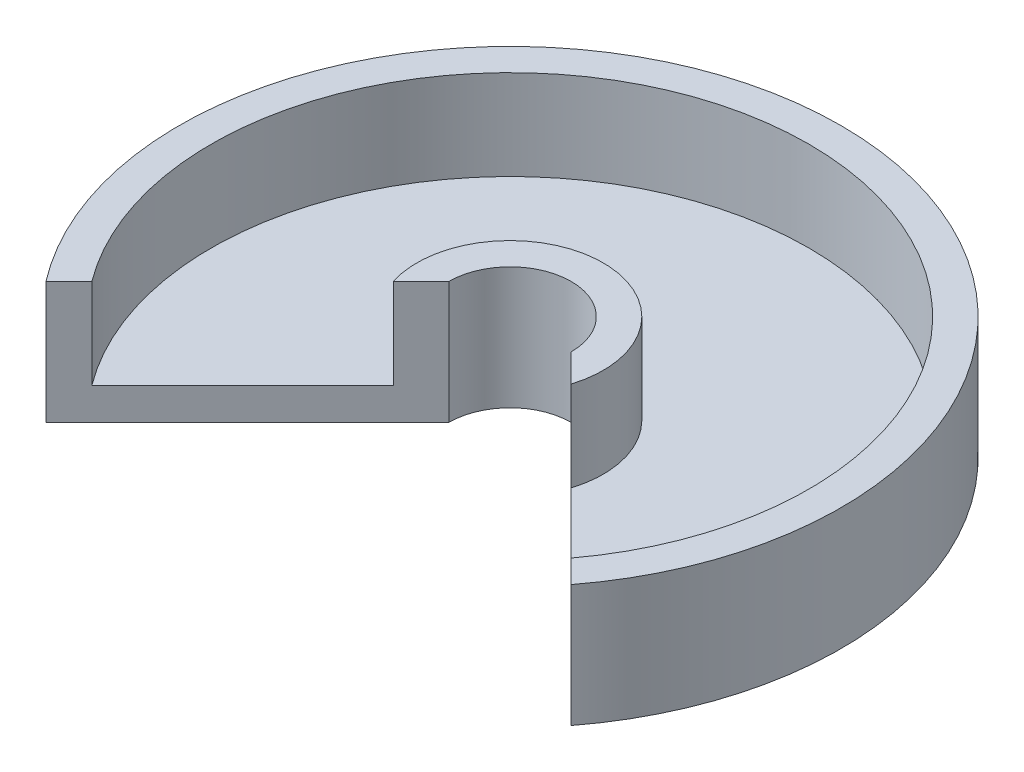
from build123d import *

# Parameters (mm, degrees)
CORTAR_EXTRUIR1_DEPTH = 10


with BuildPart() as part:
    # Croquis1 → Revolución1 (revolve)
    with BuildSketch(Plane.XY, mode=Mode.PRIVATE) as revoluci_n1_sk:
        Polygon((-17.904415608, -1.515813334), (-17.904415608, 2.284186666), (-18.904415608, 2.284186666), (-18.904415608, -0.515813334), (-25.304415608, -0.515813334), (-25.304415608, 2.284186666), (-26.304415608, 2.284186666), (-26.304415608, -1.515813334), align=None)
    revolve(revoluci_n1_sk.sketch.rotate(Axis((-16.004415608, 9.150344382, 0), (0, -1, 0)), 270), axis=Axis((-16.004415608, 9.150344382, 0), (0, -1, 0)))

    # Croquis2 → Cortar-Extruir1 (cut)
    with BuildSketch(Plane(origin=(0, 2.284186666, 0), x_dir=(1, 0, 0), z_dir=(0, 1, 0))):
        with BuildLine():
            Line((-17.904415608, 0), (-24.175391996, -6.270976388))
            ThreePointArc((-24.175391996, -6.270976388), (-16.004415608, -10.3), (-7.833439219, -6.270976388))
            Line((-7.833439219, -6.270976388), (-14.104415608, 0))
            ThreePointArc((-14.104415608, 0), (-16.004415608, -1.9), (-17.904415608, 0))
        make_face()
    extrude(amount=-CORTAR_EXTRUIR1_DEPTH, mode=Mode.SUBTRACT)


solid = part.part
